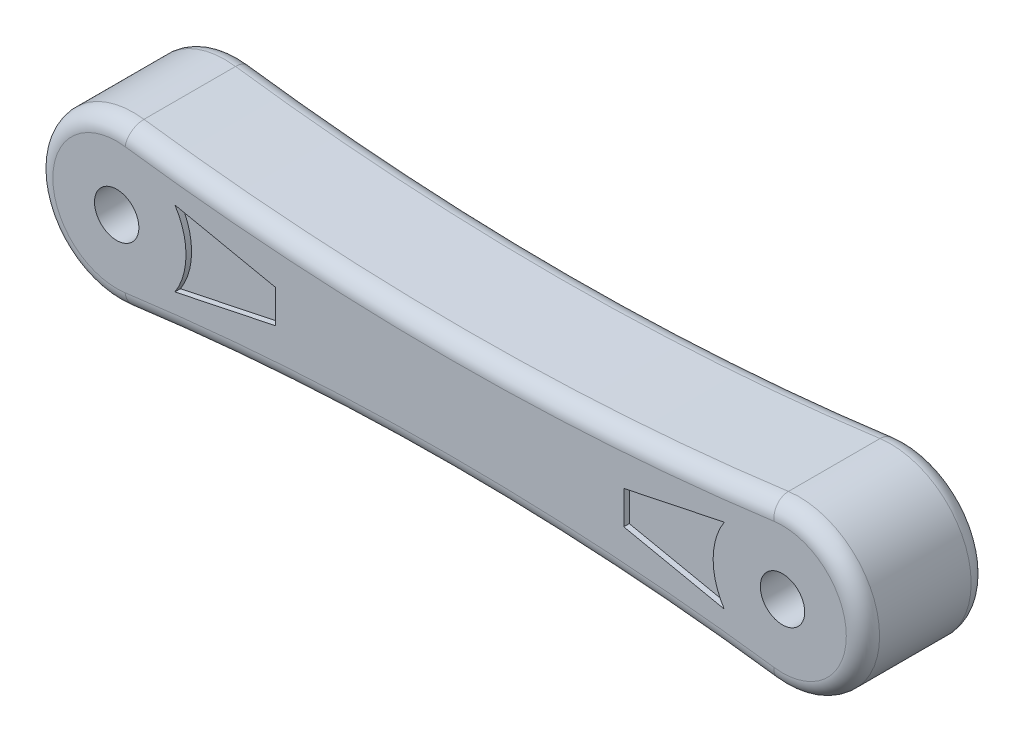
from build123d import *

# Parameters (mm, degrees)
ESQUISSE1_R             = 4
BOSS_EXTRU_1_DEPTH      = 11.25
CONG_1_R                = 3
CONG_1_OF_SYM_TRIE5_R   = 3
ENL_V_MAT_EXTRU_1_DEPTH = 1


with BuildPart() as part:
    # Esquisse1 → Boss.-Extru.1 (new body)
    with BuildSketch(Plane.XY):
        with BuildLine():
            ThreePointArc((1.924778761, 14.371681416), (-14.5, 0), (1.924778761, -14.371681416))
            ThreePointArc((1.924778761, -14.371681416), (60, -10.5), (118.075221239, -14.371681416))
            ThreePointArc((118.075221239, -14.371681416), (134.5, 0), (118.075221239, 14.371681416))
            ThreePointArc((118.075221239, 14.371681416), (60, 10.5), (1.924778761, 14.371681416))
        make_face()
        with Locations((120, 0)):
            Circle(ESQUISSE1_R, mode=Mode.SUBTRACT)
        Circle(ESQUISSE1_R, mode=Mode.SUBTRACT)
    boss_extru_1 = extrude(amount=BOSS_EXTRU_1_DEPTH)

    # Congé1
    cong_1_edges = [part.edges().sort_by_distance(p)[0] for p in [
        (60, 10.5, 11.25),
        (134.5, 0, 11.25),
        (60, -10.5, 11.25),
        (-14.5, 0, 11.25),
    ]]
    fillet(cong_1_edges, radius=CONG_1_R)

    # Symétrie5: Boss.-Extru.1 across plane
    add(boss_extru_1.mirror(Plane.XY))

    # Congé1 of Symétrie5
    cong_1_of_sym_trie5_edges = [part.edges().sort_by_distance(p)[0] for p in [
        (60, 10.5, -11.25),
        (134.5, 0, -11.25),
        (60, -10.5, -11.25),
        (-14.5, 0, -11.25),
    ]]
    fillet(cong_1_of_sym_trie5_edges, radius=CONG_1_OF_SYM_TRIE5_R)

    # Esquisse3 → Enlèv. mat.-Extru.1 (cut)
    with BuildSketch(Plane.XY.offset(11.25)):
        with BuildLine():
            Line((10.5, 6.782329983), (28.609223614, 3))
            Line((28.609223614, 3), (28.609223614, -3))
            Line((28.609223614, -3), (10.5, -6.782329983))
            ThreePointArc((10.5, -6.782329983), (12.5, 0), (10.5, 6.782329983))
        make_face()
        with BuildLine():
            Line((91.390776386, -3), (109.5, -6.782329983))
            ThreePointArc((109.5, -6.782329983), (107.5, 0), (109.5, 6.782329983))
            Line((109.5, 6.782329983), (91.390776386, 3))
            Line((91.390776386, 3), (91.390776386, -3))
        make_face()
    enl_v_mat_extru_1 = extrude(amount=-ENL_V_MAT_EXTRU_1_DEPTH, mode=Mode.SUBTRACT)

    # Symétrie6: Enlèv. mat.-Extru.1 across plane
    add(enl_v_mat_extru_1.mirror(Plane.XY), mode=Mode.SUBTRACT)


solid = part.part
